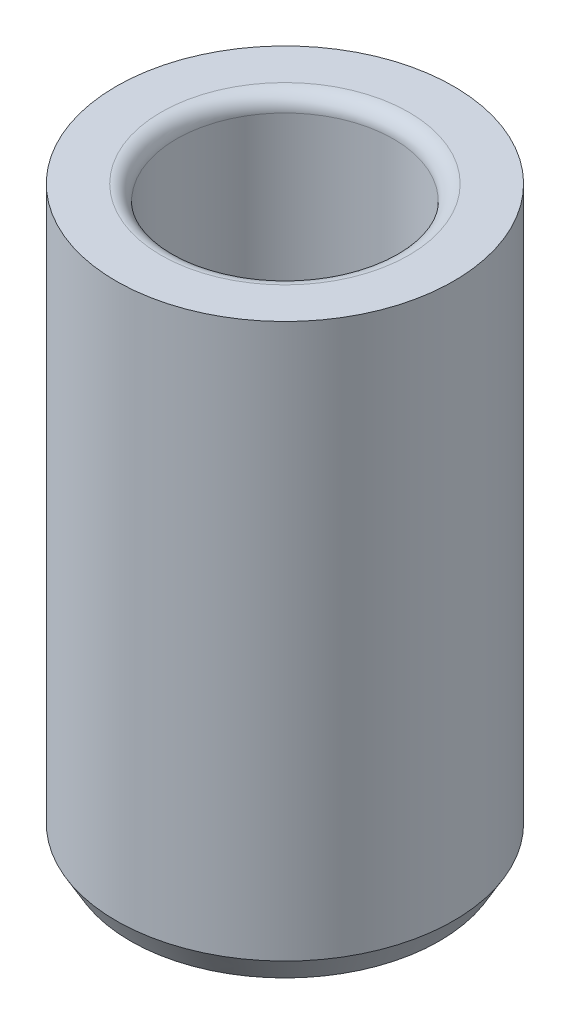
from build123d import *

# Parameters (mm, degrees)
CHAMFER1_SIZE  = 0.8128
CHAMFER1_SIZE2 = 0.469270299


with BuildPart() as part:
    # Sketch1 → BODY (revolve)
    with BuildSketch(Plane.XY, mode=Mode.PRIVATE) as body_sk:
        with BuildLine():
            Line((4.079875, 0), (5.55625, 0))
            Line((5.55625, 0), (5.55625, -19.05))
            Line((5.55625, -19.05), (3.952875, -19.05))
            Line((3.952875, -19.05), (3.571875, -18.669))
            Line((3.571875, -18.669), (3.571875, -0.508))
            ThreePointArc((3.571875, -0.508), (3.720664755, -0.148789755), (4.079875, 0))
        make_face()
    revolve(body_sk.sketch.rotate(Axis((0, 0, 0), (0, -1, 0)), 180), axis=Axis((0, 0, 0), (0, -1, 0)))

    # Chamfer1
    chamfer1_edges = [part.edges().sort_by_distance(p)[0] for p in [
        (5.55625, -19.05, 0),
    ]]
    chamfer1_side = [part.faces().sort_by_distance(p)[0] for p in [
        (5.55625, -9.525, 0),
    ]]
    chamfer(chamfer1_edges, length=CHAMFER1_SIZE, length2=CHAMFER1_SIZE2, reference=chamfer1_side[0])


solid = part.part
